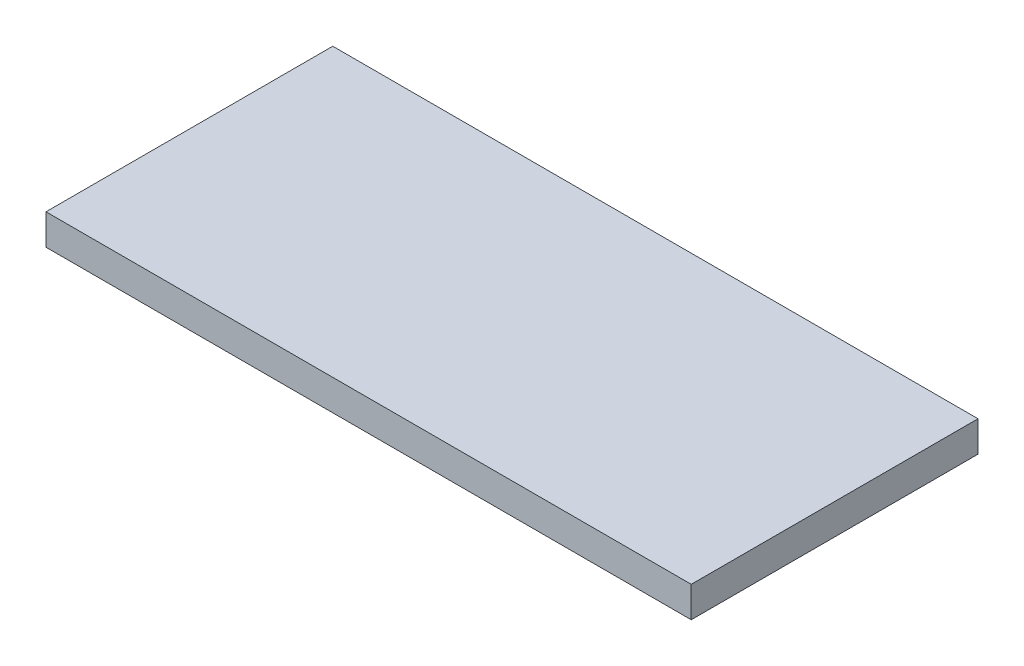
from build123d import *

# Parameters (mm, degrees)
SKETCH1_W           = 63
SKETCH1_H           = 28
BOSS_EXTRUDE1_DEPTH = 3


with BuildPart() as part:
    # Sketch1 → Boss-Extrude1 (new body)
    with BuildSketch(Plane(origin=(0, 0, 0), x_dir=(1, 0, 0), z_dir=(0, 1, 0))):
        with Locations((3.315789474, 5.710526316)):
            Rectangle(SKETCH1_W, SKETCH1_H)
    extrude(amount=BOSS_EXTRUDE1_DEPTH)


solid = part.part
